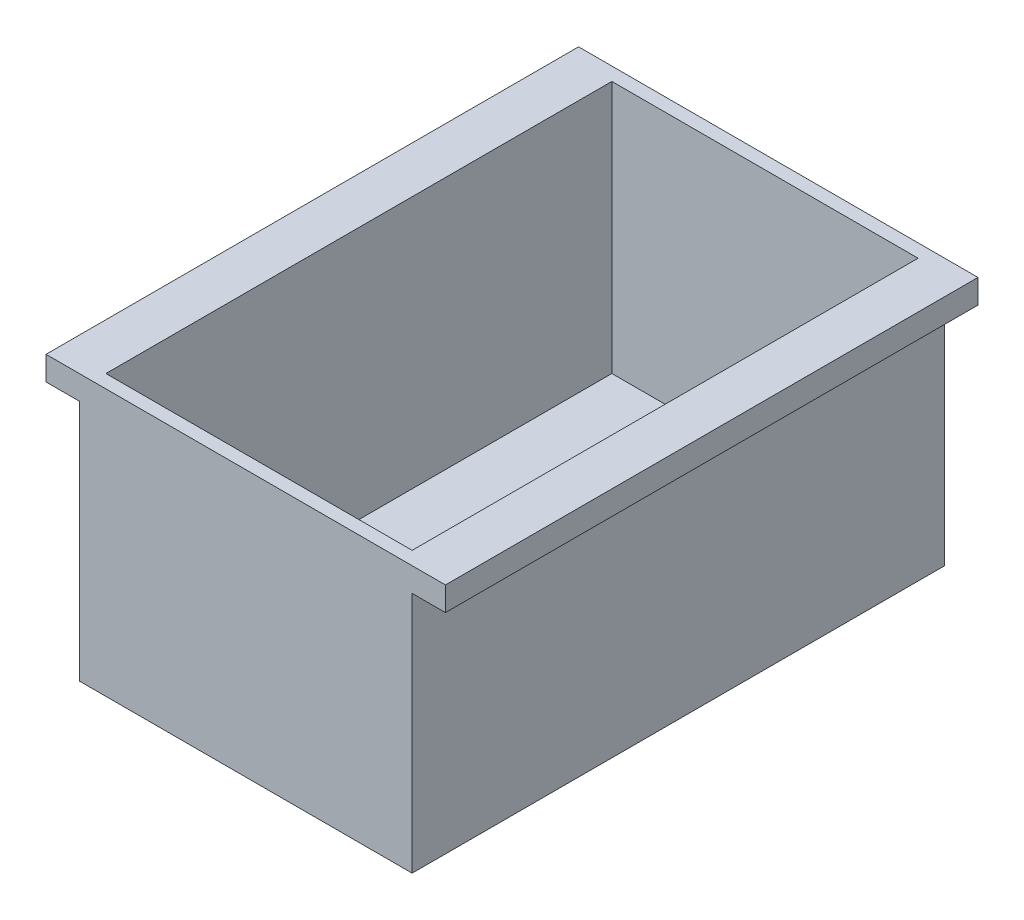
from build123d import *

# Parameters (mm, degrees)
SKETCH1_W           = 63.5
SKETCH1_H           = 101.6
BOSS_EXTRUDE1_DEPTH = 50.8
SHELL1_T            = -2.54
SKETCH2_W           = 6.35
SKETCH2_H           = 101.6
BOSS_EXTRUDE2_DEPTH = 4.572


with BuildPart() as part:
    # Sketch1 → Boss-Extrude1 (new body)
    with BuildSketch(Plane(origin=(0, 0, 0), x_dir=(1, 0, 0), z_dir=(0, 1, 0))):
        with Locations((31.75, 50.8)):
            Rectangle(SKETCH1_W, SKETCH1_H)
    extrude(amount=BOSS_EXTRUDE1_DEPTH)

    # Shell1
    shell1_openings = [part.faces().sort_by_distance(p)[0] for p in [
        (31.75, 50.8, -50.8),
    ]]
    offset(amount=SHELL1_T, openings=shell1_openings, kind=Kind.INTERSECTION)

    # Sketch2 → Boss-Extrude2 (add)
    with BuildSketch(Plane(origin=(0, 50.8, 0), x_dir=(1, 0, 0), z_dir=(0, 1, 0))):
        with Locations((-3.175, 50.8)):
            Rectangle(SKETCH2_W, SKETCH2_H)
        with Locations((66.675, 50.8)):
            Rectangle(SKETCH2_W, SKETCH2_H)
    extrude(amount=-BOSS_EXTRUDE2_DEPTH)


solid = part.part
